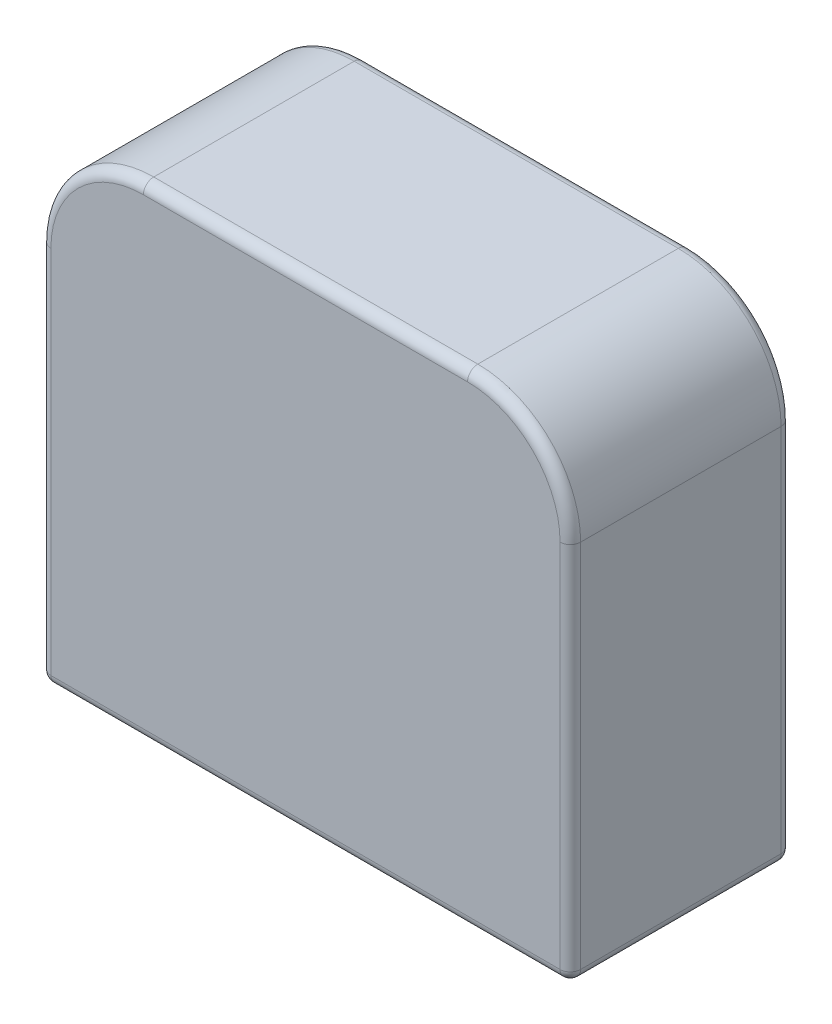
from build123d import *

# Parameters (mm, degrees)
CROQUIS1_W              = 51.53
CROQUIS1_H              = 47
SALIENTE_EXTRUIR1_DEPTH = 21.5
REDONDEO4_R             = 10
REDONDEO3_R             = 1


with BuildPart() as part:
    # Croquis1 → Saliente-Extruir1 (new body)
    with BuildSketch(Plane.XY):
        Rectangle(CROQUIS1_W, CROQUIS1_H)
    extrude(amount=SALIENTE_EXTRUIR1_DEPTH)

    # Redondeo4
    redondeo4_edges = [part.edges().sort_by_distance(p)[0] for p in [
        (-25.765, 23.5, 10.75),
        (25.765, 23.5, 10.75),
    ]]
    fillet(redondeo4_edges, radius=REDONDEO4_R)

    # Redondeo3
    redondeo3_edges = [part.edges().sort_by_distance(p)[0] for p in [
        (-25.765, -5, 0),
        (-25.765, -5, 21.5),
        (0, 23.5, 0),
        (22.836067812, 20.571067812, 0),
        (0, -23.5, 21.5),
        (-22.836067812, 20.571067812, 0),
        (0, 23.5, 21.5),
        (22.836067812, 20.571067812, 21.5),
        (-22.836067812, 20.571067812, 21.5),
        (25.765, -5, 21.5),
        (0, -23.5, 0),
        (25.765, -5, 0),
        (25.765, -23.5, 10.75),
        (-25.765, -23.5, 10.75),
    ]]
    fillet(redondeo3_edges, radius=REDONDEO3_R)


solid = part.part
